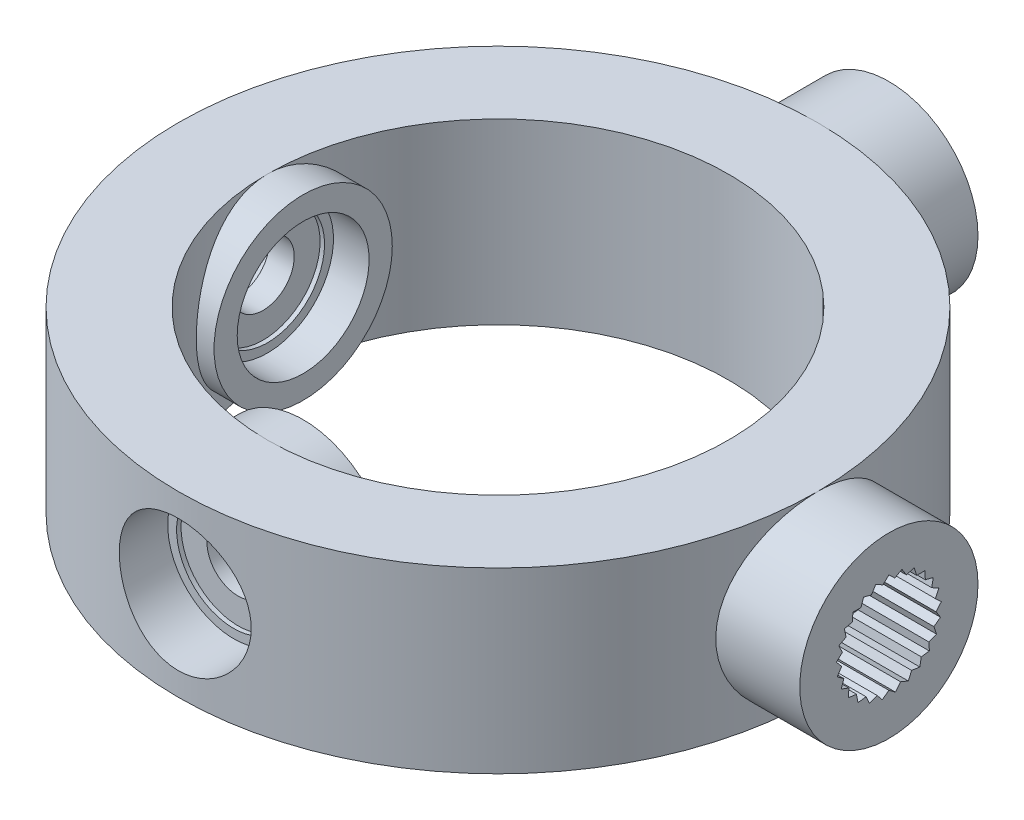
from build123d import *
from build123d.topology import SkipClean

# Parameters (mm, degrees)
SKETCH1_R                = 17.92893219
BOSS_EXTRUDE1_DEPTH      = 10
SKETCH2_R                = 12.92893219
CUT_EXTRUDE1_DEPTH       = 28.256067562
BOSS_EXTRUDE2_REACH      = 46.834
BOSS_EXTRUDE2_END_RADIUS = 17.92893219
SKETCH4_R                = 5
BOSS_EXTRUDE4_REACH      = 40.744
BOSS_EXTRUDE4_END_RADIUS = 12.92893219
SKETCH7_R                = 5
SKETCH8_R                = 1.75
CUT_EXTRUDE3_DEPTH       = 7
BOSS_EXTRUDE5_REACH      = 48.578
BOSS_EXTRUDE5_END_RADIUS = 17.92893219
SKETCH11_R               = 5
BOSS_EXTRUDE6_REACH      = 42.749
BOSS_EXTRUDE6_END_RADIUS = 12.92893219
SKETCH12_R               = 5
SKETCH13_R               = 1.75
CUT_EXTRUDE4_DEPTH       = 7
CUT_EXTRUDE5_DEPTH       = 4
CIRPATTERN1_COUNT        = 2
CIRPATTERN1_ANGLE        = 270
SKETCH15_R               = 3.7
CUT_EXTRUDE6_DEPTH       = 3.1
CUT_EXTRUDE7_START       = 2
SKETCH16_R               = 3.7
CUT_EXTRUDE7_DEPTH       = 2
SKETCH17_R               = 3.2
SKETCH17_R_2             = 1.75
CUT_EXTRUDE8_DEPTH       = 0.25
CUT_EXTRUDE9_START       = -0.25
SKETCH18_R               = 3.2
SKETCH18_R_2             = 1.75
CUT_EXTRUDE9_DEPTH       = 0.25
CIRPATTERN2_COUNT        = 2
CIRPATTERN2_ANGLE        = 90


with BuildPart() as part:
    # Sketch1 → Boss-Extrude1 (new body)
    with BuildSketch(Plane(origin=(0, 0, 0), x_dir=(1, 0, 0), z_dir=(0, 1, 0))):
        with Locations(Location((0, 0, 0), (0, 0, 270))):
            Circle(SKETCH1_R)
    extrude(amount=BOSS_EXTRUDE1_DEPTH)

    # Sketch2 → Cut-Extrude1 (cut, through all)
    with BuildSketch(Plane(origin=(0, 10, 0), x_dir=(1, 0, 0), z_dir=(0, 1, 0))):
        with Locations(Location((0, 0, 0), (0, 0, 270))):
            Circle(SKETCH2_R)
    extrude(amount=-CUT_EXTRUDE1_DEPTH, mode=Mode.SUBTRACT)

    # Boss-Extrude2: up to this cylinder (the profile starts outside it)
    with SkipClean():  # the faces are left unmerged after this step: merging them gives an invalid solid
        boss_extrude2_end = Plane(origin=(0, 5, 0), z_dir=(0, -1, 0)) * Cylinder(BOSS_EXTRUDE2_END_RADIUS, 130.52586438, mode=Mode.PRIVATE)
        # Sketch4 → Boss-Extrude2 (add, up to the surface)
        with BuildSketch(Plane(origin=(21.92893219, 0, 0), x_dir=(0, 0, -1), z_dir=(1, 0, 0)), mode=Mode.PRIVATE) as boss_extrude2_sk1:
            with Locations((0, 5)):
                Circle(SKETCH4_R)
        boss_extrude2_tool1 = extrude(boss_extrude2_sk1.sketch, amount=-BOSS_EXTRUDE2_REACH, mode=Mode.PRIVATE) - boss_extrude2_end
        add(boss_extrude2_tool1.solids().sort_by_distance((21.928932, 5, 0))[0])

    # Boss-Extrude4: up to this cylinder (the profile starts inside it)
    with SkipClean():  # the faces are left unmerged after this step: merging them gives an invalid solid
        boss_extrude4_end = Plane(origin=(0, 5, 0), z_dir=(0, 1, 0)) * Cylinder(BOSS_EXTRUDE4_END_RADIUS, 108.34586438, mode=Mode.PRIVATE)
        # Sketch7 → Boss-Extrude4 (add, up to the surface)
        with BuildSketch(Plane(origin=(-10.92893219, 0, 0), x_dir=(0, 0, -1), z_dir=(1, 0, 0)), mode=Mode.PRIVATE) as boss_extrude4_sk1:
            with Locations((0, 5)):
                Circle(SKETCH7_R)
        boss_extrude4_tool1 = extrude(boss_extrude4_sk1.sketch, amount=-BOSS_EXTRUDE4_REACH, mode=Mode.PRIVATE) & boss_extrude4_end
        add(boss_extrude4_tool1.solids().sort_by_distance((-10.928932, 5, 0))[0])

    # Sketch8 → Cut-Extrude3 (cut)
    with SkipClean():  # the faces are left unmerged after this step: merging them gives an invalid solid
        with BuildSketch(Plane(origin=(-17.92893219, 0, 0), x_dir=(0, 0, -1), z_dir=(1, 0, 0))):
            with Locations(Location((0, 5, 0), (0, 0, 180))):
                Circle(SKETCH8_R)
        extrude(amount=CUT_EXTRUDE3_DEPTH, mode=Mode.SUBTRACT)

    # Boss-Extrude5: up to this cylinder (the profile starts outside it)
    with SkipClean():  # the faces are left unmerged after this step: merging them gives an invalid solid
        boss_extrude5_end = Plane(origin=(0, 5, 0), z_dir=(0, -1, 0)) * Cylinder(BOSS_EXTRUDE5_END_RADIUS, 134.01386438, mode=Mode.PRIVATE)
        # Sketch11 → Boss-Extrude5 (add, up to the surface)
        with BuildSketch(Plane.XY.offset(-21.92893219), mode=Mode.PRIVATE) as boss_extrude5_sk1:
            with Locations(Location((0, 5, 0), (0, 0, 270))):
                Circle(SKETCH11_R)
        boss_extrude5_tool1 = extrude(boss_extrude5_sk1.sketch, amount=BOSS_EXTRUDE5_REACH, mode=Mode.PRIVATE) - boss_extrude5_end
        add(boss_extrude5_tool1.solids().sort_by_distance((0, 5, -21.928932))[0])

    # Boss-Extrude6: up to this cylinder (the profile starts inside it)
    boss_extrude6_end = Plane(origin=(0, 5, 0), z_dir=(0, 1, 0)) * Cylinder(BOSS_EXTRUDE6_END_RADIUS, 112.35586438, mode=Mode.PRIVATE)
    # Sketch12 → Boss-Extrude6 (add, up to the surface)
    with BuildSketch(Plane.XY.offset(10.92893219), mode=Mode.PRIVATE) as boss_extrude6_sk1:
        with Locations(Location((0, 5, 0), (0, 0, 270))):
            Circle(SKETCH12_R)
    boss_extrude6_tool1 = extrude(boss_extrude6_sk1.sketch, amount=BOSS_EXTRUDE6_REACH, mode=Mode.PRIVATE) & boss_extrude6_end
    add(boss_extrude6_tool1.solids().sort_by_distance((0, 5, 10.928932))[0])

    # Sketch13 → Cut-Extrude4 (cut)
    with BuildSketch(Plane.XY.offset(17.92893219)):
        with Locations((0, 5)):
            Circle(SKETCH13_R)
    extrude(amount=-CUT_EXTRUDE4_DEPTH, mode=Mode.SUBTRACT)

    # Sketch14 → Cut-Extrude5 (cut)
    with BuildSketch(Plane(origin=(0, 0, -21.92893219), x_dir=(-1, 0, 0), z_dir=(0, 0, -1))):
        Polygon((0, 7.95), (-0.332740219, 7.633910043), (-0.733635167, 7.857320325), (-0.977313364, 7.468411788), (-1.421173339, 7.585104706), (-1.560478316, 7.147814142), (-2.019413962, 7.150457451), (-2.045592677, 6.692261435), (-2.49076738, 6.580689045), (-2.402174927, 6.130377718), (-2.805616723, 5.911600133), (-2.607819692, 5.497468212), (-2.944178849, 5.185232033), (-2.649605554, 4.833300948), (-2.89774739, 4.447225122), (-2.524906955, 4.179607999), (-2.669239805, 3.74395109), (-2.241559166, 3.577463297), (-2.273014066, 3.11959923), (-1.81736597, 3.064701807), (-1.733966494, 2.613399867), (-1.278980987, 2.673542221), (-1.08596743, 2.257159367), (-0.660232925, 2.428562532), (-0.369733039, 2.073261631), (0, 2.345155717), (0.369733039, 2.073261631), (0.660232925, 2.428562532), (1.08596743, 2.257159367), (1.278980987, 2.673542221), (1.733966494, 2.613399867), (1.81736597, 3.064701807), (2.273014066, 3.11959923), (2.241559166, 3.577463297), (2.669239805, 3.74395109), (2.524906955, 4.179607999), (2.89774739, 4.447225122), (2.649605554, 4.833300948), (2.944178849, 5.185232033), (2.607819692, 5.497468212), (2.805616723, 5.911600133), (2.402174927, 6.130377718), (2.49076738, 6.580689045), (2.045592677, 6.692261435), (2.019413962, 7.150457451), (1.560478316, 7.147814142), (1.421173339, 7.585104706), (0.977313364, 7.468411788), (0.733635167, 7.857320325), (0.332740219, 7.633910043), align=None)
    cut_extrude5 = extrude(amount=-CUT_EXTRUDE5_DEPTH, mode=Mode.SUBTRACT)

    # CirPattern1: Cut-Extrude5 ×2 about axis
    cirpattern1_axis = Axis((0, 0, 0), (0, 1, 0))
    for i in range(1, CIRPATTERN1_COUNT):
        add(cut_extrude5.rotate(cirpattern1_axis, i * CIRPATTERN1_ANGLE / (CIRPATTERN1_COUNT - 1)), mode=Mode.SUBTRACT)

    # Sketch15 → Cut-Extrude6 (cut)
    with BuildSketch(Plane.XY.offset(17.92893219)):
        with Locations((0, 5)):
            Circle(SKETCH15_R)
    cut_extrude6 = extrude(amount=-CUT_EXTRUDE6_DEPTH, mode=Mode.SUBTRACT)

    # Sketch16 → Cut-Extrude7 (cut)
    with BuildSketch(Plane.XY.offset(10.92893219).offset(CUT_EXTRUDE7_START)):
        with Locations((0, 5)):
            Circle(SKETCH16_R)
    cut_extrude7 = extrude(amount=-CUT_EXTRUDE7_DEPTH, mode=Mode.SUBTRACT)

    # Sketch17 → Cut-Extrude8 (cut)
    with BuildSketch(Plane.XY.offset(14.82893219)):
        with Locations((0, 5)):
            Circle(SKETCH17_R)
        with Locations((0, 5)):
            Circle(SKETCH17_R_2, mode=Mode.SUBTRACT)
    cut_extrude8 = extrude(amount=-CUT_EXTRUDE8_DEPTH, mode=Mode.SUBTRACT)

    # Sketch18 → Cut-Extrude9 (cut)
    with BuildSketch(Plane(origin=(0, 0, 12.92893219), x_dir=(-1, 0, 0), z_dir=(0, 0, -1)).offset(CUT_EXTRUDE9_START)):
        with Locations(Location((0, 5, 0), (0, 0, 180))):
            Circle(SKETCH18_R)
        with Locations(Location((0, 5, 0), (0, 0, 180))):
            Circle(SKETCH18_R_2, mode=Mode.SUBTRACT)
    cut_extrude9 = extrude(amount=CUT_EXTRUDE9_DEPTH, mode=Mode.SUBTRACT)

    # CirPattern2: Cut-Extrude6, Cut-Extrude7, Cut-Extrude8, Cut-Extrude9 ×2 about axis
    cirpattern2_axis = Axis((0, 10, 0), (0, -1, 0))
    add([cut_extrude6.rotate(cirpattern2_axis, i * CIRPATTERN2_ANGLE / (CIRPATTERN2_COUNT - 1)) for i in range(1, CIRPATTERN2_COUNT)], mode=Mode.SUBTRACT)
    add([cut_extrude7.rotate(cirpattern2_axis, i * CIRPATTERN2_ANGLE / (CIRPATTERN2_COUNT - 1)) for i in range(1, CIRPATTERN2_COUNT)], mode=Mode.SUBTRACT)
    add([cut_extrude8.rotate(cirpattern2_axis, i * CIRPATTERN2_ANGLE / (CIRPATTERN2_COUNT - 1)) for i in range(1, CIRPATTERN2_COUNT)], mode=Mode.SUBTRACT)
    add([cut_extrude9.rotate(cirpattern2_axis, i * CIRPATTERN2_ANGLE / (CIRPATTERN2_COUNT - 1)) for i in range(1, CIRPATTERN2_COUNT)], mode=Mode.SUBTRACT)


solid = part.part
